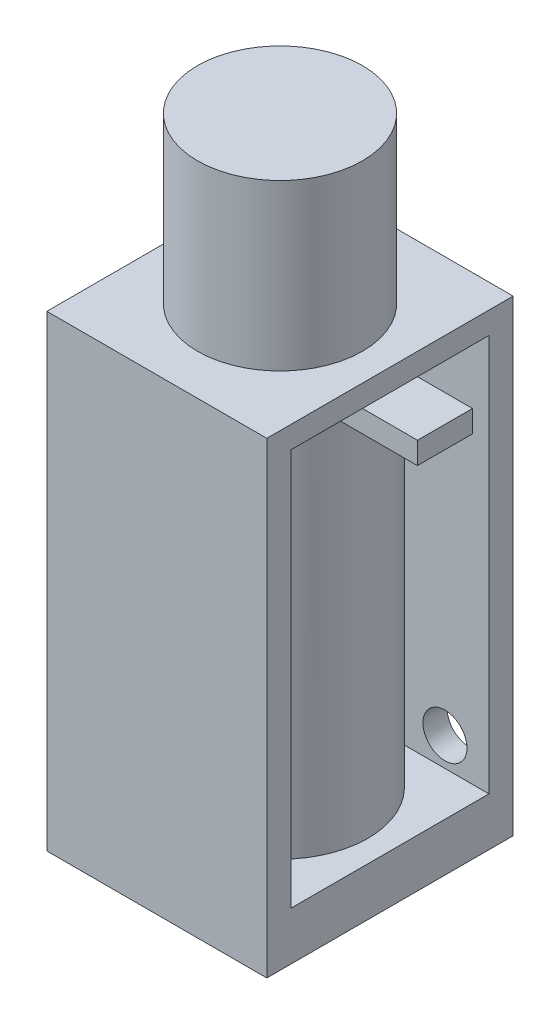
from build123d import *

# Parameters (mm, degrees)
SKETCH2_R           = 4
BOSS_EXTRUDE1_DEPTH = 18
SKETCH3_W           = 11.2
SKETCH3_H           = 21.25
SKETCH3_W_2         = 9
SKETCH3_H_2         = 18.05
BOSS_EXTRUDE2_DEPTH = 5
BOSS_EXTRUDE3_START = 19.05
SKETCH4_R           = 3.75
BOSS_EXTRUDE3_DEPTH = 7.5
BOSS_EXTRUDE4_START = -2.2
SKETCH4_3_R         = 1.5
BOSS_EXTRUDE4_DEPTH = 1.5
SKETCH5_R           = 1
CUT_EXTRUDE1_DEPTH  = 1.1
SKETCH6_W           = 2
SKETCH6_H           = 1.25
BOSS_EXTRUDE6_DEPTH = 1


with BuildPart() as part:
    # Sketch2 → Boss-Extrude1 (new body)
    with BuildSketch(Plane(origin=(0, 0, 0), x_dir=(1, 0, 0), z_dir=(0, 1, 0))):
        with Locations(Location((0, 0, 0), (0, 0, 270))):
            Circle(SKETCH2_R)
    extrude(amount=BOSS_EXTRUDE1_DEPTH)

    # Sketch3 → Boss-Extrude2 (add, symmetric)
    with BuildSketch(Plane(origin=(0, 0, 0), x_dir=(0, 0, -1), z_dir=(1, 0, 0))):
        with Locations((0, 8.425)):
            Rectangle(SKETCH3_W, SKETCH3_H)
        with Locations((0, 9.025)):
            Rectangle(SKETCH3_W_2, SKETCH3_H_2, mode=Mode.SUBTRACT)
    extrude(amount=BOSS_EXTRUDE2_DEPTH, both=True)

    # Sketch4 → Boss-Extrude3 (add)
    with BuildSketch(Plane(origin=(0, 0, 0), x_dir=(1, 0, 0), z_dir=(0, 1, 0)).offset(BOSS_EXTRUDE3_START)):
        with Locations(Location((0, 0, 0), (0, 0, 90))):
            Circle(SKETCH4_R)
    extrude(amount=BOSS_EXTRUDE3_DEPTH)

    # Sketch4<3> → Boss-Extrude4 (add)
    with BuildSketch(Plane(origin=(0, 0, 0), x_dir=(1, 0, 0), z_dir=(0, 1, 0)).offset(BOSS_EXTRUDE4_START)):
        with Locations(Location((0, 0, 0), (0, 0, 270))):
            Circle(SKETCH4_3_R)
    extrude(amount=-BOSS_EXTRUDE4_DEPTH)

    # Sketch5 → Cut-Extrude1 (cut)
    with BuildSketch(Plane(origin=(0, 0, -5.6), x_dir=(-1, 0, 0), z_dir=(0, 0, -1))):
        with Locations(Location((-3, 1.3, 0), (0, 0, 90))):
            Circle(SKETCH5_R)
        with Locations(Location((3, 11.3, 0), (0, 0, 90))):
            Circle(SKETCH5_R)
    extrude(amount=-CUT_EXTRUDE1_DEPTH, mode=Mode.SUBTRACT)

    # Sketch6 → Boss-Extrude6 (add)
    with BuildSketch(Plane.XZ.offset(-18.05)):
        Polygon((5, 0), (5, -1.25), (7.5, -1.25), (7.5, 1.25), (5, 1.25), align=None)
        with Locations((4, -0.625)):
            Rectangle(SKETCH6_W, SKETCH6_H)
        with Locations((4, 0.625)):
            Rectangle(SKETCH6_W, SKETCH6_H)
    extrude(amount=BOSS_EXTRUDE6_DEPTH)


solid = part.part
